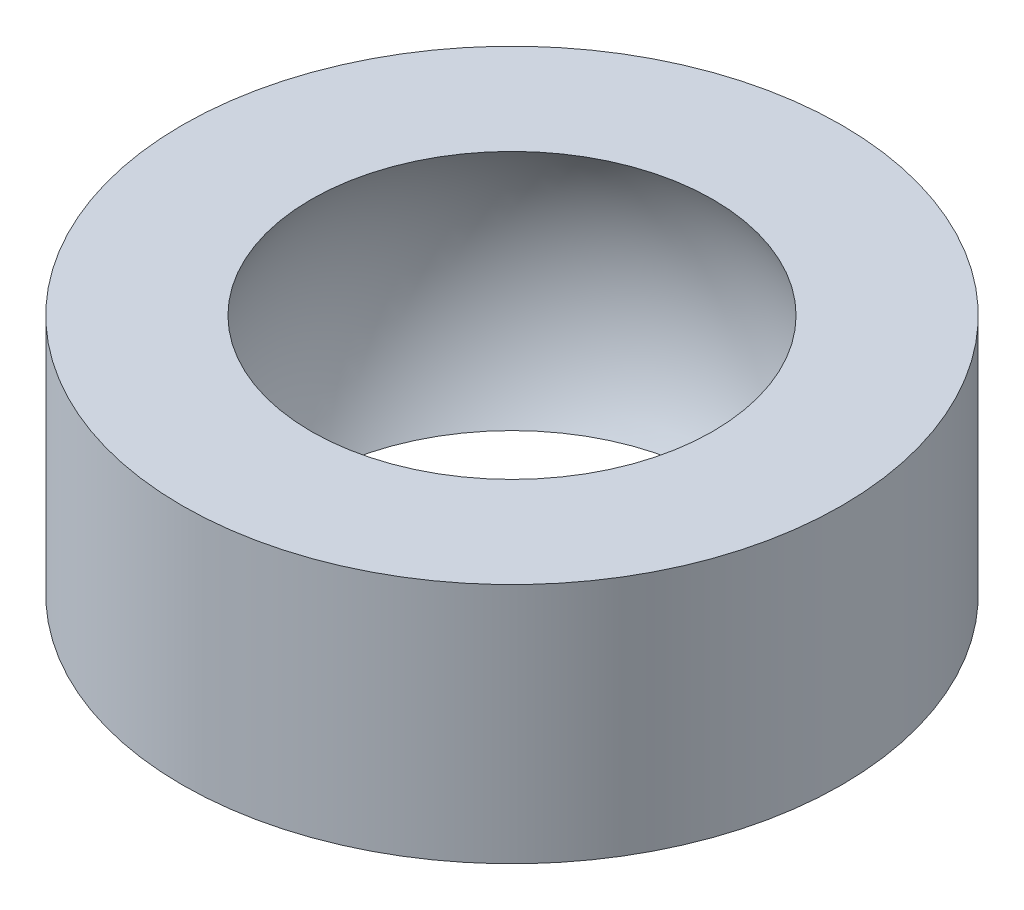
from build123d import *

# Parameters (mm, degrees)
SKETCH_1_R      = 9
EXTRUDE_1_DEPTH = 3.3


with BuildPart() as part:
    # Эскиз1 → Бобышка-Вытянуть1 (new, symmetric)
    with BuildSketch(Plane(origin=(0, 0, 0), x_dir=(1, 0, 0), z_dir=(0, 1, 0))):
        with Locations(Location((0, 0, 0), (0, 0, 270))):
            Circle(SKETCH_1_R)
    extrude(amount=EXTRUDE_1_DEPTH, both=True)

    # Эскиз2 → Вырез-Повернуть1 (revolve, cut)
    with BuildSketch(Plane.XY):
        with BuildLine():
            Line((0, 6.4), (0, -6.4))
            ThreePointArc((0, -6.4), (6.4, 0), (0, 6.4))
        make_face()
    revolve(axis=Axis((0, 0, 0), (0, 1, 0)), mode=Mode.SUBTRACT)


solid = part.part
